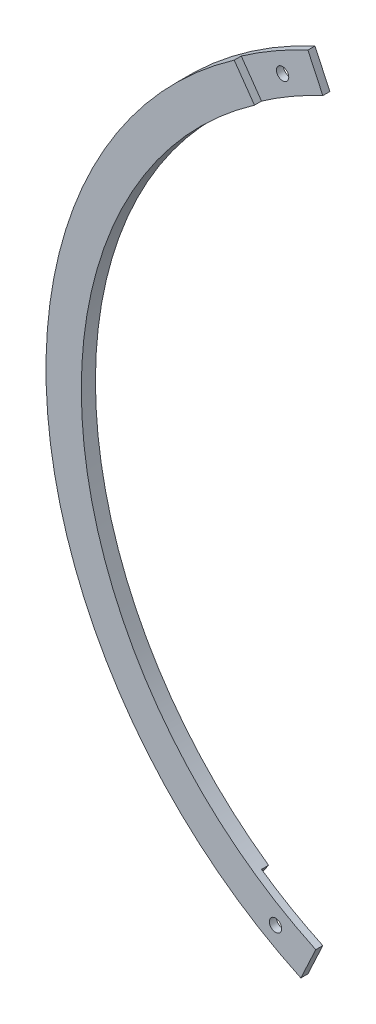
from build123d import *

# Parameters (mm, degrees)
BOSS_EXTRU_1_DEPTH      = 4
ESQUISSE3_R             = 1.75
ENL_V_MAT_EXTRU_1_DEPTH = 10
ENL_V_START             = -2
ENL_V_MAT_EXTRU_2_DEPTH = 2
ENL_V_MAT_EXTRU_3_DEPTH = 2


with BuildPart() as part:
    # Esquisse1 → Boss.-Extru.1 (new body)
    with BuildSketch(Plane.XY):
        with BuildLine():
            Line((-48.6011001, -104.225395509), (-52.827282718, -113.28847338))
            ThreePointArc((-52.827282718, -113.28847338), (-105.423930727, -67.162451043), (-125, 0))
            ThreePointArc((-125, 0), (-105.423930727, 67.162451043), (-52.827282718, 113.28847338))
            Line((-52.827282718, 113.28847338), (-48.6011001, 104.225395509))
            ThreePointArc((-48.6011001, 104.225395509), (-115, 0), (-48.6011001, -104.225395509))
        make_face()
    extrude(amount=BOSS_EXTRU_1_DEPTH)

    # Esquisse3 → Enlèv. mat.-Extru.1 (cut)
    with BuildSketch(Plane.XY.offset(4)):
        with Locations((-60, 103.923048454)):
            Circle(ESQUISSE3_R)
        with Locations((-60, -103.923048454)):
            Circle(ESQUISSE3_R)
    extrude(amount=-ENL_V_MAT_EXTRU_1_DEPTH, mode=Mode.SUBTRACT)

    # Esquisse4 → Enlèv. mat.-Extru.2 (cut)
    with BuildSketch(Plane.XY.offset(4).offset(ENL_V_START)):
        with BuildLine():
            Line((-71.697054544, 102.394005536), (-65.96129018, 94.202485093))
            ThreePointArc((-65.96129018, 94.202485093), (-57.5, 99.592921435), (-48.6011001, 104.225395509))
            Line((-48.6011001, 104.225395509), (-52.827282718, 113.28847338))
            ThreePointArc((-52.827282718, 113.28847338), (-62.5, 108.253175473), (-71.697054544, 102.394005536))
        make_face()
    extrude(amount=ENL_V_MAT_EXTRU_2_DEPTH, mode=Mode.SUBTRACT)

    # Esquisse6 → Enlèv. mat.-Extru.3 (cut)
    with BuildSketch(Plane(origin=(0, 0, 0), x_dir=(-1, 0, 0), z_dir=(0, 0, -1))):
        with BuildLine():
            Line((65.96129018, -94.202485093), (71.697054544, -102.394005536))
            ThreePointArc((71.697054544, -102.394005536), (62.5, -108.253175473), (52.827282718, -113.28847338))
            Line((52.827282718, -113.28847338), (48.6011001, -104.225395509))
            ThreePointArc((48.6011001, -104.225395509), (57.5, -99.592921435), (65.96129018, -94.202485093))
        make_face()
    extrude(amount=-ENL_V_MAT_EXTRU_3_DEPTH, mode=Mode.SUBTRACT)


solid = part.part
